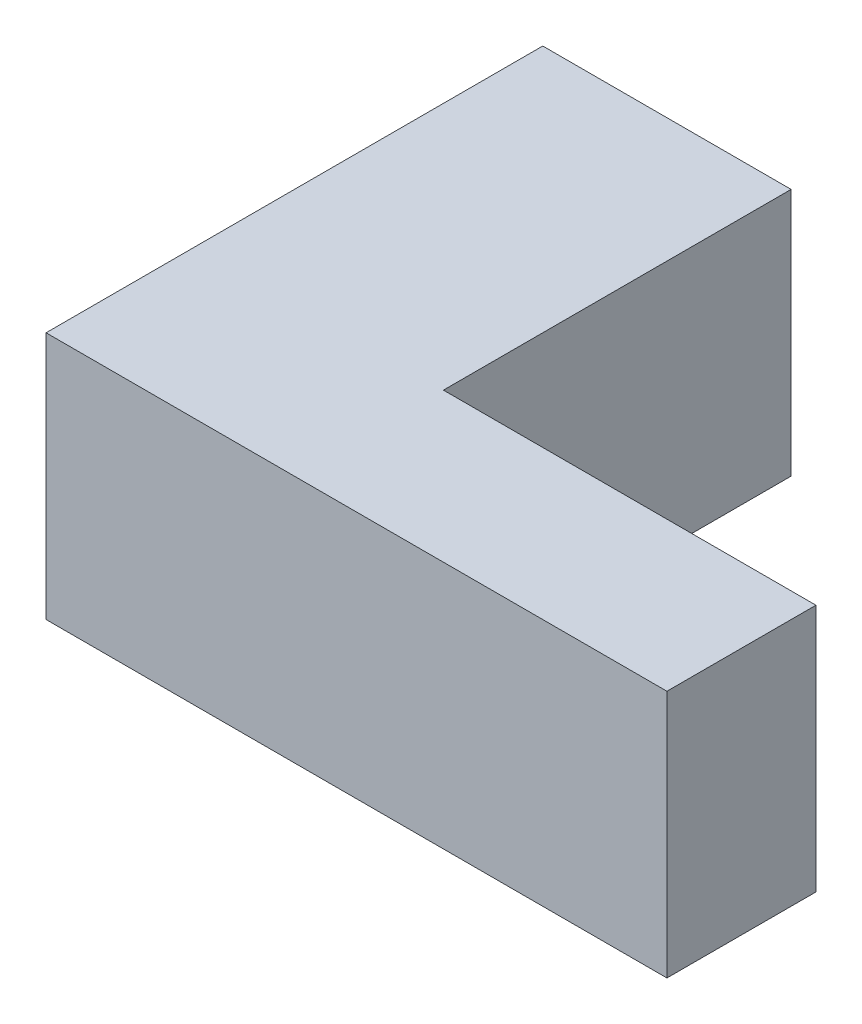
from build123d import *

# Parameters (mm, degrees)
SCHIZZO1_W                   = 10
SCHIZZO1_H                   = 10
ESTRUSIONE_ESTRUSIONE1_DEPTH = 20
SCHIZZO2_W                   = 15
SCHIZZO2_H                   = 6
ESTRUSIONE_ESTRUSIONE2_DEPTH = 5


with BuildPart() as part:
    # Schizzo1 → Estrusione-Estrusione1 (new body)
    with BuildSketch(Plane.XY):
        Rectangle(SCHIZZO1_W, SCHIZZO1_H)
    extrude(amount=ESTRUSIONE_ESTRUSIONE1_DEPTH)

    # Schizzo2 → Estrusione-Estrusione2 (add, symmetric)
    with BuildSketch(Plane(origin=(0, 0, 0), x_dir=(1, 0, 0), z_dir=(0, 1, 0))):
        with Locations((12.5, -17)):
            Rectangle(SCHIZZO2_W, SCHIZZO2_H)
    extrude(amount=ESTRUSIONE_ESTRUSIONE2_DEPTH, both=True)


solid = part.part
